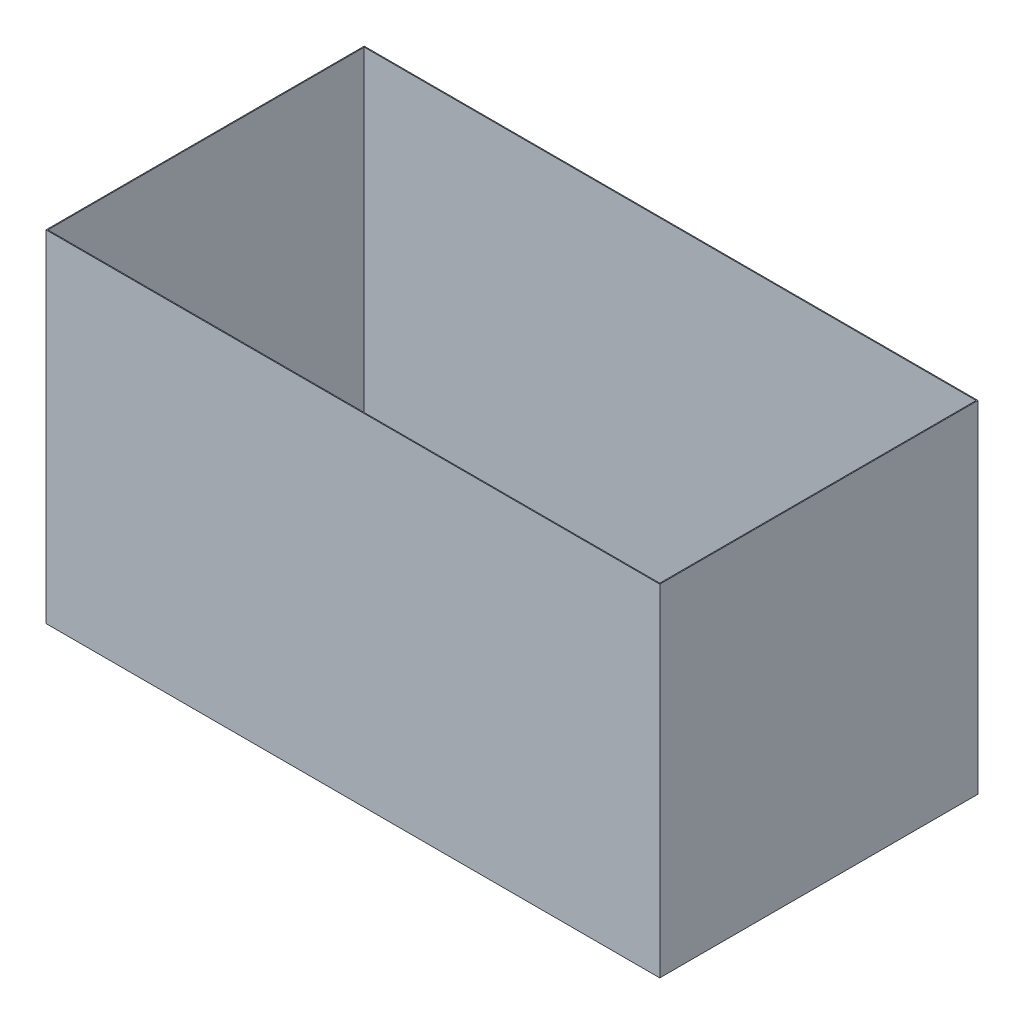
from build123d import *

# Parameters (mm, degrees)
MASTER_FOOTPRINT_W    = 1350
MASTER_FOOTPRINT_H    = 700
BATH_BASE_PLATE_DEPTH = 750
BATH_SHELL_2MM_T      = -2


with BuildPart() as part:
    # MASTER_FOOTPRINT → BATH_BASE_PLATE (new body)
    with BuildSketch(Plane(origin=(0, 0, 0), x_dir=(1, 0, 0), z_dir=(0, 1, 0))):
        with Locations((675, 350)):
            Rectangle(MASTER_FOOTPRINT_W, MASTER_FOOTPRINT_H)
    extrude(amount=BATH_BASE_PLATE_DEPTH)

    # BATH_SHELL_2MM
    bath_shell_2mm_openings = [part.faces().sort_by_distance(p)[0] for p in [
        (675, 750, -350),
    ]]
    offset(amount=BATH_SHELL_2MM_T, openings=bath_shell_2mm_openings, kind=Kind.INTERSECTION)


solid = part.part
